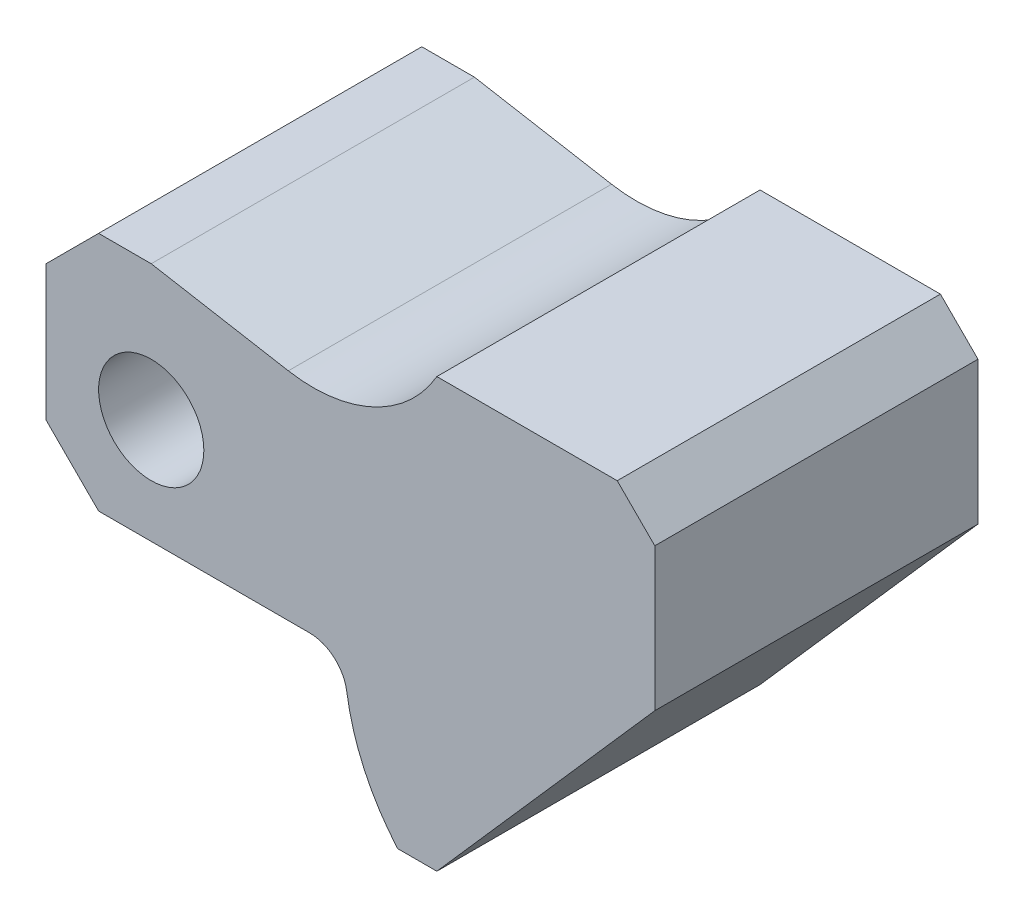
from build123d import *

# Parameters (mm, degrees)
SKETCH1_R           = 7
BOSS_EXTRUDE1_DEPTH = 43


with BuildPart() as part:
    # Sketch1 → Boss-Extrude1 (new body)
    with BuildSketch(Plane.XY):
        with BuildLine():
            ThreePointArc((35.066626358, -25), (38.331862134, -26.213413763), (40.012265097, -29.264705868))
            ThreePointArc((40.012265097, -29.264705868), (42.349095333, -37.11567206), (46.788067571, -44))
            Line((46.788067571, -44), (52, -44))
            Line((52, -44), (81, -11))
            Line((81, -11), (81, 8))
            Line((81, 8), (76, 13))
            Line((76, 13), (52, 13))
            ThreePointArc((52, 13), (43.574972961, 5.276069151), (32.243084988, 3.783251905))
            Line((32.243084988, 3.783251905), (14, 7))
            Line((14, 7), (7, 7))
            Line((7, 7), (0, 0))
            Line((0, 0), (0, -18))
            Line((0, -18), (7, -25))
            Line((7, -25), (35.066626358, -25))
        make_face()
        with Locations((14, -11)):
            Circle(SKETCH1_R, mode=Mode.SUBTRACT)
    extrude(amount=BOSS_EXTRUDE1_DEPTH)


solid = part.part
